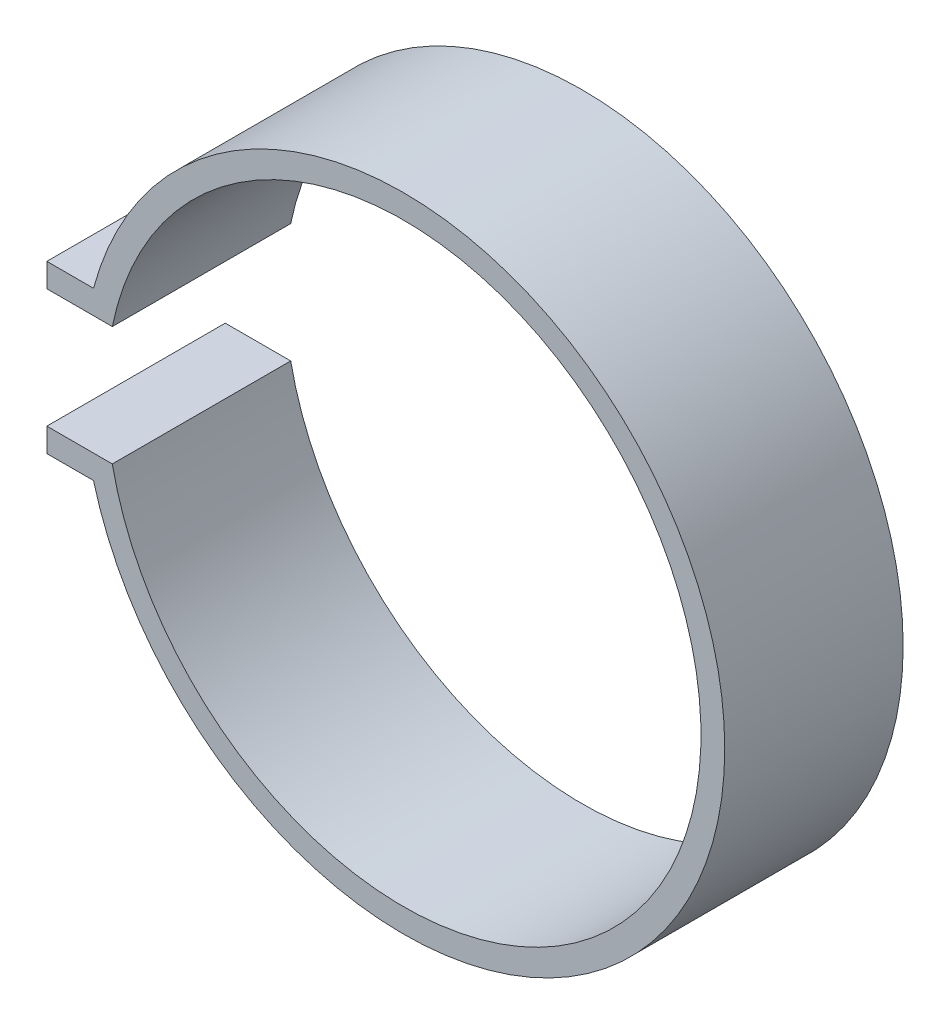
from build123d import *

# Parameters (mm, degrees)
EXTRUDE_THIN1_DEPTH = 30


with BuildPart() as part:
    # Sketch1 → Extrude-Thin1 (new body)
    with BuildSketch(Plane.XY):
        with BuildLine():
            Line((-60, 10), (-48.989794856, 10))
            ThreePointArc((-48.989794856, 10), (50, 0), (-48.989794856, -10))
            Line((-48.989794856, -10), (-60, -10))
            Line((-60, -10), (-60, -14))
            Line((-60, -14), (-52.153619242, -14))
            ThreePointArc((-52.153619242, -14), (54, 0), (-52.153619242, 14))
            Line((-52.153619242, 14), (-60, 14))
            Line((-60, 14), (-60, 10))
        make_face()
    extrude(amount=EXTRUDE_THIN1_DEPTH)


solid = part.part
